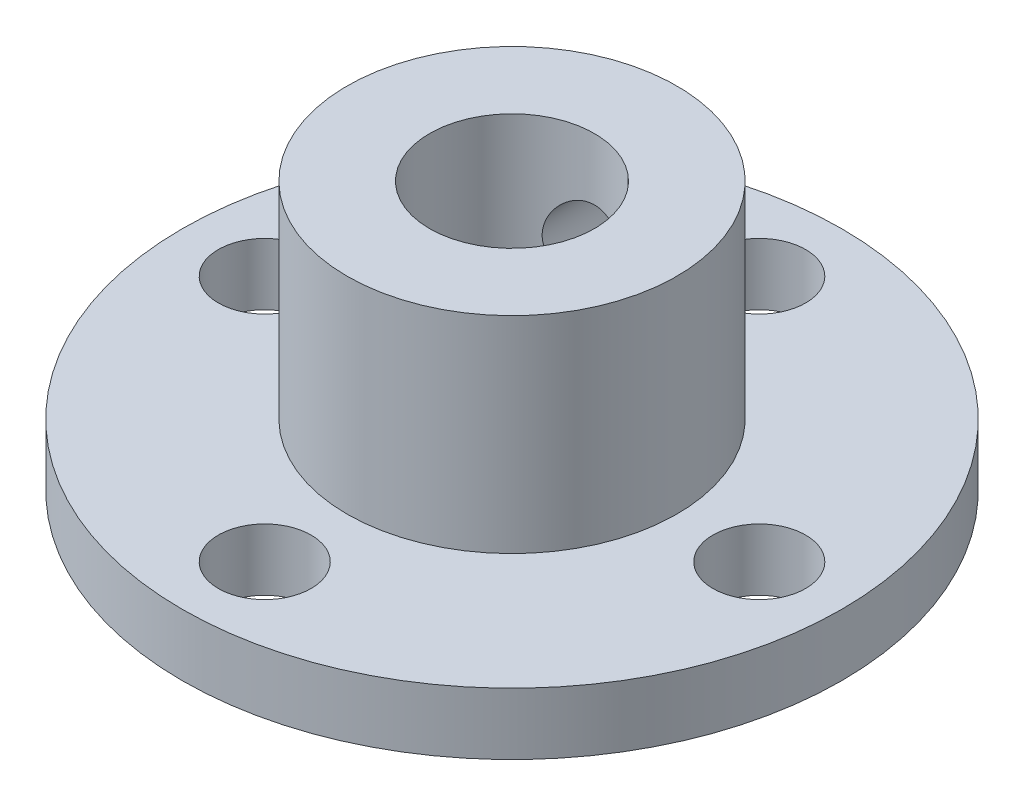
from build123d import *

# Parameters (mm, degrees)
SKETCH1_R               = 16
BOSS_EXTRUDE1_DEPTH     = 3
SKETCH2_R               = 8
BOSS_EXTRUDE2_DEPTH     = 10
CUT_EXTRUDE1_REACH      = 28.096
SKETCH3_R               = 4
CUT_EXTRUDE2_REACH      = 26.739
SKETCH4_R               = 2.25
CUT_EXTRUDE3_REACH      = 28.096
CUT_EXTRUDE3_END_RADIUS = 8
SKETCH5_R               = 2


with BuildPart() as part:
    # Sketch1 → Boss-Extrude1 (new body)
    with BuildSketch(Plane(origin=(0, 0, 0), x_dir=(1, 0, 0), z_dir=(0, 1, 0))):
        with Locations(Location((0, 0, 0), (0, 0, 270))):
            Circle(SKETCH1_R)
    extrude(amount=BOSS_EXTRUDE1_DEPTH)

    # Sketch2 → Boss-Extrude2 (add)
    with BuildSketch(Plane(origin=(0, 3, 0), x_dir=(1, 0, 0), z_dir=(0, 1, 0))):
        with Locations(Location((0, 0, 0), (0, 0, 270))):
            Circle(SKETCH2_R)
    extrude(amount=BOSS_EXTRUDE2_DEPTH)

    # Sketch3 → Cut-Extrude1 (cut, up to next)
    with BuildSketch(Plane(origin=(0, 13, 0), x_dir=(1, 0, 0), z_dir=(0, 1, 0)), mode=Mode.PRIVATE) as cut_extrude1_sk1:
        with Locations(Location((0, 0, 0), (0, 0, 270))):
            Circle(SKETCH3_R)
    cut_extrude1_tool1 = extrude(cut_extrude1_sk1.sketch, amount=-CUT_EXTRUDE1_REACH, mode=Mode.PRIVATE) & part.part
    add(cut_extrude1_tool1.solids().sort_by_distance((0, 13, 0))[0], mode=Mode.SUBTRACT)

    # Sketch4 → Cut-Extrude2 (cut, up to next)
    with BuildSketch(Plane(origin=(0, 3, 0), x_dir=(1, 0, 0), z_dir=(0, 1, 0)), mode=Mode.PRIVATE) as cut_extrude2_sk1:
        with Locations(Location((0, 12, 0), (0, 0, 270))):
            Circle(SKETCH4_R)
    cut_extrude2_tool1 = extrude(cut_extrude2_sk1.sketch, amount=-CUT_EXTRUDE2_REACH, mode=Mode.PRIVATE) & part.part
    # Sketch4 → Cut-Extrude2 (cut, up to next)
    with BuildSketch(Plane(origin=(0, 3, 0), x_dir=(1, 0, 0), z_dir=(0, 1, 0)), mode=Mode.PRIVATE) as cut_extrude2_sk2:
        with Locations(Location((12, 0, 0), (0, 0, 270))):
            Circle(SKETCH4_R)
    cut_extrude2_tool2 = extrude(cut_extrude2_sk2.sketch, amount=-CUT_EXTRUDE2_REACH, mode=Mode.PRIVATE) & part.part
    # Sketch4 → Cut-Extrude2 (cut, up to next)
    with BuildSketch(Plane(origin=(0, 3, 0), x_dir=(1, 0, 0), z_dir=(0, 1, 0)), mode=Mode.PRIVATE) as cut_extrude2_sk3:
        with Locations(Location((0, -12, 0), (0, 0, 270))):
            Circle(SKETCH4_R)
    cut_extrude2_tool3 = extrude(cut_extrude2_sk3.sketch, amount=-CUT_EXTRUDE2_REACH, mode=Mode.PRIVATE) & part.part
    # Sketch4 → Cut-Extrude2 (cut, up to next)
    with BuildSketch(Plane(origin=(0, 3, 0), x_dir=(1, 0, 0), z_dir=(0, 1, 0)), mode=Mode.PRIVATE) as cut_extrude2_sk4:
        with Locations(Location((-12, 0, 0), (0, 0, 270))):
            Circle(SKETCH4_R)
    cut_extrude2_tool4 = extrude(cut_extrude2_sk4.sketch, amount=-CUT_EXTRUDE2_REACH, mode=Mode.PRIVATE) & part.part
    add(cut_extrude2_tool1.solids().sort_by_distance((0, 3, -12))[0], mode=Mode.SUBTRACT)
    add(cut_extrude2_tool2.solids().sort_by_distance((12, 3, 0))[0], mode=Mode.SUBTRACT)
    add(cut_extrude2_tool3.solids().sort_by_distance((0, 3, 12))[0], mode=Mode.SUBTRACT)
    add(cut_extrude2_tool4.solids().sort_by_distance((-12, 3, 0))[0], mode=Mode.SUBTRACT)

    # Cut-Extrude3: up to this cylinder (the profile starts inside it)
    cut_extrude3_end = Plane(origin=(0, 8, 0), z_dir=(0, -1, 0)) * Cylinder(CUT_EXTRUDE3_END_RADIUS, 73.192, mode=Mode.PRIVATE)
    # Sketch5 → Cut-Extrude3 (cut, up to the surface)
    with BuildSketch(Plane.XY, mode=Mode.PRIVATE) as cut_extrude3_sk1:
        with Locations((0, 8)):
            Circle(SKETCH5_R)
    cut_extrude3_tool1 = extrude(cut_extrude3_sk1.sketch, amount=-CUT_EXTRUDE3_REACH, mode=Mode.PRIVATE) & cut_extrude3_end
    add(cut_extrude3_tool1.solids().sort_by_distance((0, 8, 0))[0], mode=Mode.SUBTRACT)


solid = part.part
